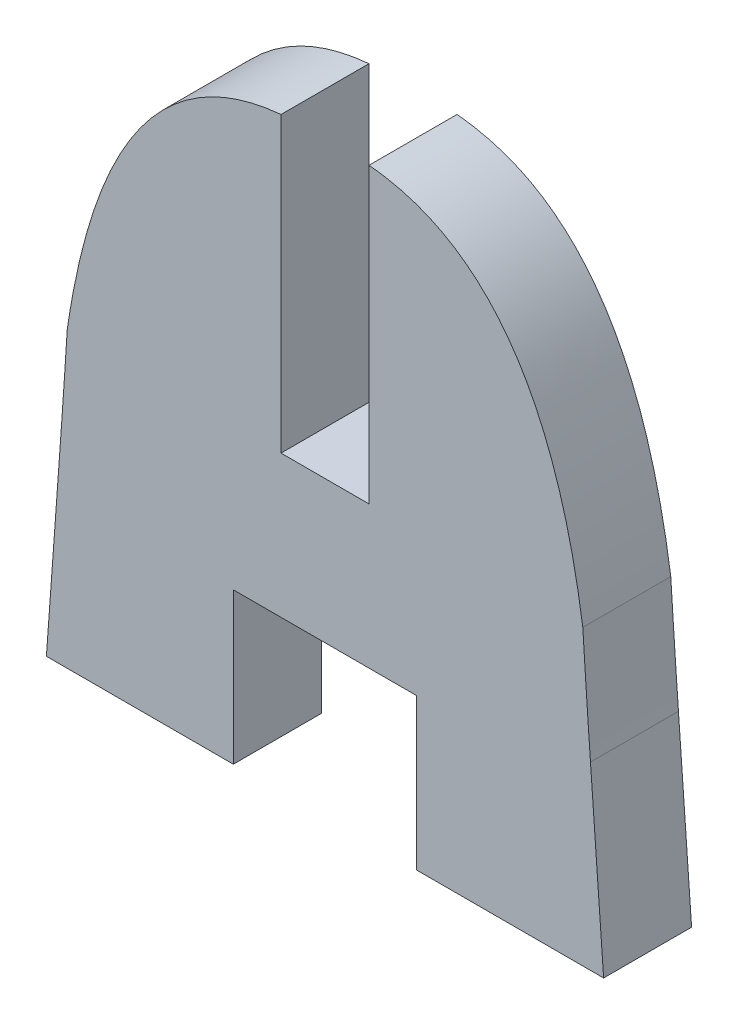
from build123d import *

# Parameters (mm, degrees)
RESSALTO_EXTRUS_O1_DEPTH = 3


with BuildPart() as part:
    # Esboço1 → Ressalto-extrusão1 (new body)
    with BuildSketch(Plane.XY):
        with BuildLine():
            Line((19, 0), (12.625, 0))
            Line((12.625, 0), (12.625, 5.15))
            Line((12.625, 5.15), (11, 5.15))
            Line((11, 5.15), (8, 5.15))
            Line((8, 5.15), (6.375, 5.15))
            Line((6.375, 5.15), (6.375, 0))
            Line((6.375, 0), (0, 0))
            Line((0, 0), (0.448555141, 6.151613366))
            ThreePointArc((0.448555141, 6.151613366), (0.584055906, 8.075483405), (0.710041083, 10))
            add(Edge.make_bspline(
                [(0.710041083, 10), (2.087312964, 19.459463986), (8, 20)],
                knots=[0, 0, 0, 0.891892797, 0.891892797, 0.891892797], degree=2))
            Line((8, 20), (8, 10))
            Line((8, 10), (11, 10))
            Line((11, 10), (11, 20))
            add(Edge.make_bspline(
                [(18.289958917, 10), (16.912687036, 19.459463986), (11, 20)],
                knots=[0, 0, 0, 0.891892797, 0.891892797, 0.891892797], degree=2))
            ThreePointArc((18.289958917, 10), (18.415944094, 8.075483405), (18.551444859, 6.151613366))
            Line((18.551444859, 6.151613366), (19, 0))
        make_face()
    extrude(amount=RESSALTO_EXTRUS_O1_DEPTH)


solid = part.part
